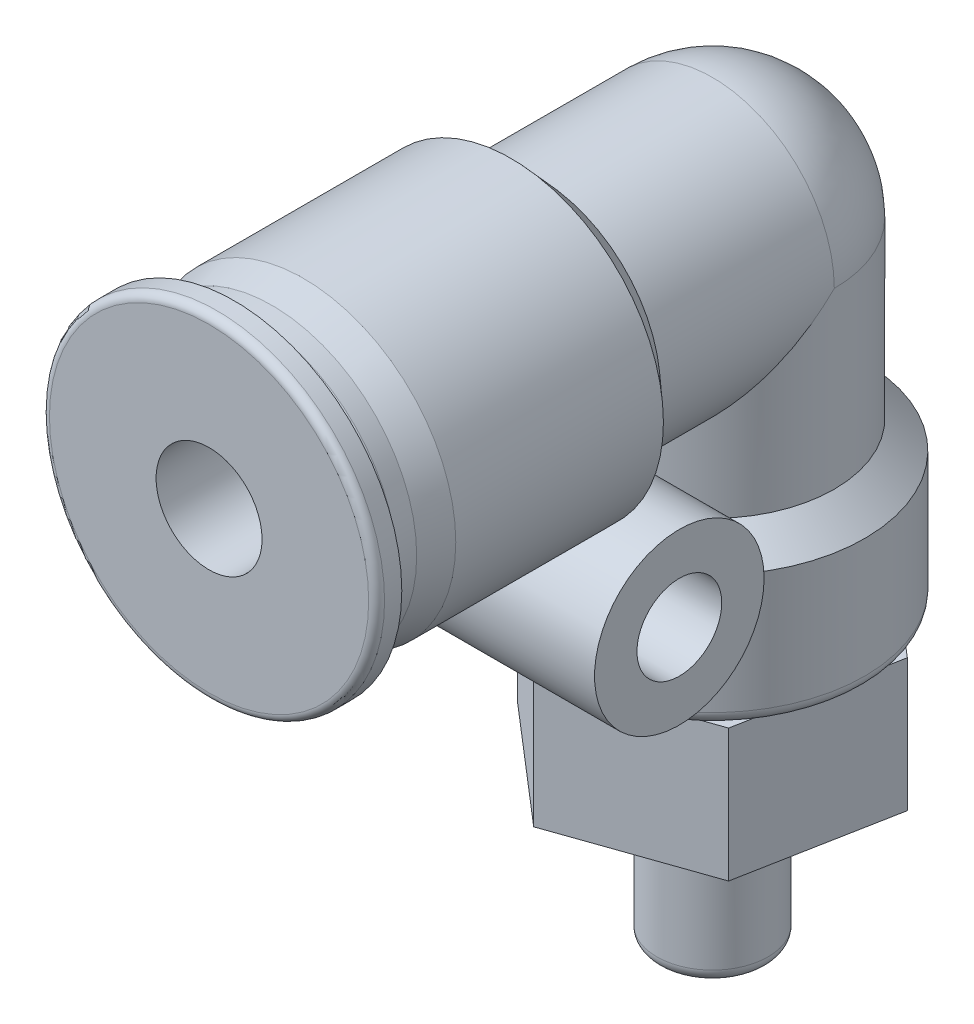
from build123d import *

# Parameters (mm, degrees)
SKETCH_3_R               = 2
CUT_EXTRUDE_1_DEPTH      = 19
EXTRUDE_1_DEPTH          = 5.75
EXTRUDE_1_DEPTH_BACK     = 5.75
SKETCH_5_R               = 3.2
CUT_EXTRUDE_2_DEPTH      = 5.75
CUT_EXTRUDE_2_DEPTH_BACK = 5.75
SKETCH_6_R               = 1.6
FILLET_1_R               = 0.5
EXTRUDE_2_DEPTH          = 5


with BuildPart() as part:
    # 草图1 → 旋转1 (revolve)
    with BuildSketch(Plane(origin=(0, 0, 0), x_dir=(0, 0, -1), z_dir=(1, 0, 0))):
        with BuildLine():
            Line((-19, 0), (-19, 6.025))
            ThreePointArc((-19, 6.025), (-18.912132034, 6.237132034), (-18.7, 6.325))
            Line((-18.7, 6.325), (-18.05, 6.325))
            Line((-18.05, 6.325), (-18.05, 3))
            Line((-18.05, 3), (-17.575, 3))
            Line((-17.575, 3), (-17.575, 5.2625))
            ThreePointArc((-17.575, 5.2625), (-17.516421356, 5.403921356), (-17.375, 5.4625))
            Line((-17.375, 5.4625), (-16.625, 5.4625))
            Line((-16.625, 5.4625), (-15.4375, 5.75))
            Line((-15.4375, 5.75), (-7.6, 5.75))
            Line((-7.6, 5.75), (-6.564535349, 4.6))
            Line((-6.564535349, 4.6), (0, 4.6))
            ThreePointArc((0, 4.6), (3.252691193, 3.252691193), (4.6, 0))
            Line((4.6, 0), (-19, 0))
        make_face()
    revolve(axis=Axis((0, 0, -4.6), (0, 0, 1)))

    # 草图2 → 旋转2 (revolve)
    with BuildSketch(Plane(origin=(0, 0, 0), x_dir=(0, 0, -1), z_dir=(1, 0, 0))):
        Polygon((-5.75, -12.6), (-5.75, -7.6), (-4.6, -6.564535349), (-4.6, 0), (0, 0), (0, -23.6), (-2.1, -23.6), (-2.1, -12.6), align=None)
    revolve(axis=Axis((0, 0, 0), (0, -1, 0)))

    # 草图3 → 切除-拉伸1 (cut)
    with BuildSketch(Plane.XY):
        Circle(SKETCH_3_R)
    extrude(amount=CUT_EXTRUDE_1_DEPTH, mode=Mode.SUBTRACT)

    # 草图4 → 切除-旋转1 (revolve, cut)
    with BuildSketch(Plane(origin=(0, 0, 0), x_dir=(0, 0, -1), z_dir=(1, 0, 0))):
        with BuildLine():
            Line((2, 0), (2, -19))
            Line((2, -19), (0, -19))
            Line((0, -19), (0, 2))
            ThreePointArc((0, 2), (1.414213562, 1.414213562), (2, 0))
        make_face()
    revolve(axis=Axis((0, -19, 0), (0, 1, 0)), mode=Mode.SUBTRACT)

    # 草图5 → 凸台-拉伸1 (add, two sides: drawn at the far end of the back side and taken through both)
    with BuildSketch(Plane(origin=(0, 0, 0), x_dir=(0, 0, -1), z_dir=(1, 0, 0)).offset(-EXTRUDE_1_DEPTH_BACK)):
        with Locations((-7, -7)):
            Circle(SKETCH_5_R)
    extrude(amount=EXTRUDE_1_DEPTH + EXTRUDE_1_DEPTH_BACK)

    # 草图6 → 切除-拉伸2 (cut, two sides: drawn at the far end of the back side and taken through both)
    with BuildSketch(Plane(origin=(0, 0, 0), x_dir=(0, 0, -1), z_dir=(1, 0, 0)).offset(-CUT_EXTRUDE_2_DEPTH_BACK)):
        with Locations((-7, -7)):
            Circle(SKETCH_6_R)
    extrude(amount=CUT_EXTRUDE_2_DEPTH + CUT_EXTRUDE_2_DEPTH_BACK, mode=Mode.SUBTRACT)

    # 圆角1
    fillet_1_edges = [part.edges().sort_by_distance(p)[0] for p in [
        (0, -12.6, -5.75),
        (0, -23.6, -2.1),
    ]]
    fillet(fillet_1_edges, radius=FILLET_1_R)

    # 草图7 → 凸台-拉伸2 (add)
    with BuildSketch(Plane.XZ.offset(12.6)):
        Polygon((5.449702089, -1.906326436), (4.375778165, 3.766417234), (-1.073923923, 5.67274367), (-5.449702089, 1.906326436), (-4.375778165, -3.766417234), (1.073923923, -5.67274367), align=None)
    extrude(amount=EXTRUDE_2_DEPTH)


solid = part.part
